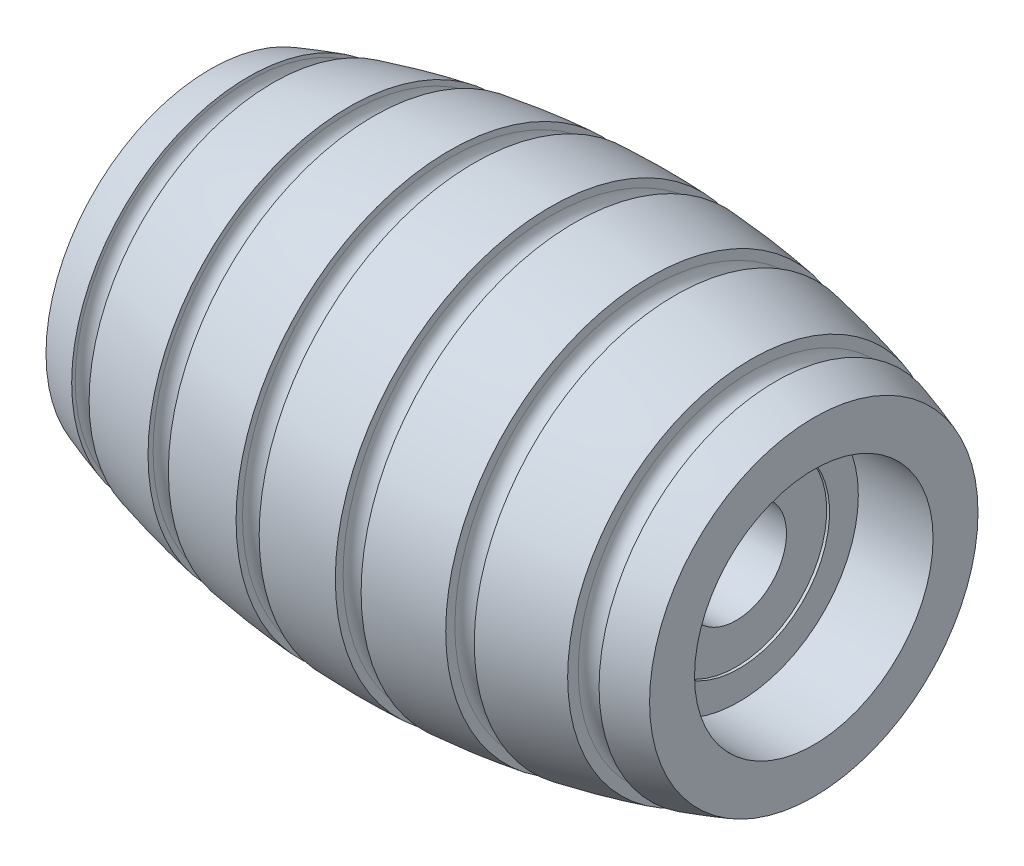
from build123d import *


with BuildPart() as part:
    # Sketch1 → Revolve1 (revolve)
    with BuildSketch(Plane.XY, mode=Mode.PRIVATE) as revolve1_sk:
        with BuildLine():
            Line((-21, 11.427038972), (-21, 8.3))
            Line((-21, 8.3), (-15.8, 8.3))
            Line((-15.8, 8.3), (-15.8, 6.3))
            Line((-15.8, 6.3), (-15.6, 6.3))
            Line((-15.6, 6.3), (-15.6, 3.5))
            Line((-15.6, 3.5), (15.6, 3.5))
            Line((15.6, 3.5), (15.6, 6.3))
            Line((15.6, 6.3), (15.8, 6.3))
            Line((15.8, 6.3), (15.8, 8.3))
            Line((15.8, 8.3), (21, 8.3))
            Line((21, 8.3), (21, 11.427038972))
            ThreePointArc((21, 11.427038972), (19.679740028, 11.873486171), (18.35, 12.290850463))
            Line((18.35, 12.290850463), (18.35, 12.040969848))
            ThreePointArc((18.35, 12.040969848), (17.5, 11.190969848), (16.65, 12.040969848))
            Line((16.65, 12.040969848), (16.65, 12.778279186))
            ThreePointArc((16.65, 12.778279186), (14.01283277, 13.434566421), (11.35, 13.97741592))
            Line((11.35, 13.97741592), (11.35, 13.625873247))
            ThreePointArc((11.35, 13.625873247), (10.5, 12.775873247), (9.65, 13.625873247))
            Line((9.65, 13.625873247), (9.65, 14.262468881))
            ThreePointArc((9.65, 14.262468881), (7.006178832, 14.612308294), (4.35, 14.850828724))
            Line((4.35, 14.850828724), (4.35, 14.403469937))
            ThreePointArc((4.35, 14.403469937), (3.5, 13.553469937), (2.65, 14.403469937))
            Line((2.65, 14.403469937), (2.65, 14.944680628))
            ThreePointArc((2.65, 14.944680628), (0, 15), (-2.65, 14.944680628))
            Line((-2.65, 14.944680628), (-2.65, 14.403469937))
            ThreePointArc((-2.65, 14.403469937), (-3.5, 13.553469937), (-4.35, 14.403469937))
            Line((-4.35, 14.403469937), (-4.35, 14.850828724))
            ThreePointArc((-4.35, 14.850828724), (-7.006178832, 14.612308294), (-9.65, 14.262468881))
            Line((-9.65, 14.262468881), (-9.65, 13.625873247))
            ThreePointArc((-9.65, 13.625873247), (-10.5, 12.775873247), (-11.35, 13.625873247))
            Line((-11.35, 13.625873247), (-11.35, 13.97741592))
            ThreePointArc((-11.35, 13.97741592), (-14.01283277, 13.434566421), (-16.65, 12.778279186))
            Line((-16.65, 12.778279186), (-16.65, 12.040969848))
            ThreePointArc((-16.65, 12.040969848), (-17.5, 11.190969848), (-18.35, 12.040969848))
            Line((-18.35, 12.040969848), (-18.35, 12.290850463))
            ThreePointArc((-18.35, 12.290850463), (-19.679740028, 11.873486171), (-21, 11.427038972))
        make_face()
    revolve(revolve1_sk.sketch.rotate(Axis((-24.5, 0, 0), (1, 0, 0)), 90), axis=Axis((-24.5, 0, 0), (1, 0, 0)))


solid = part.part
